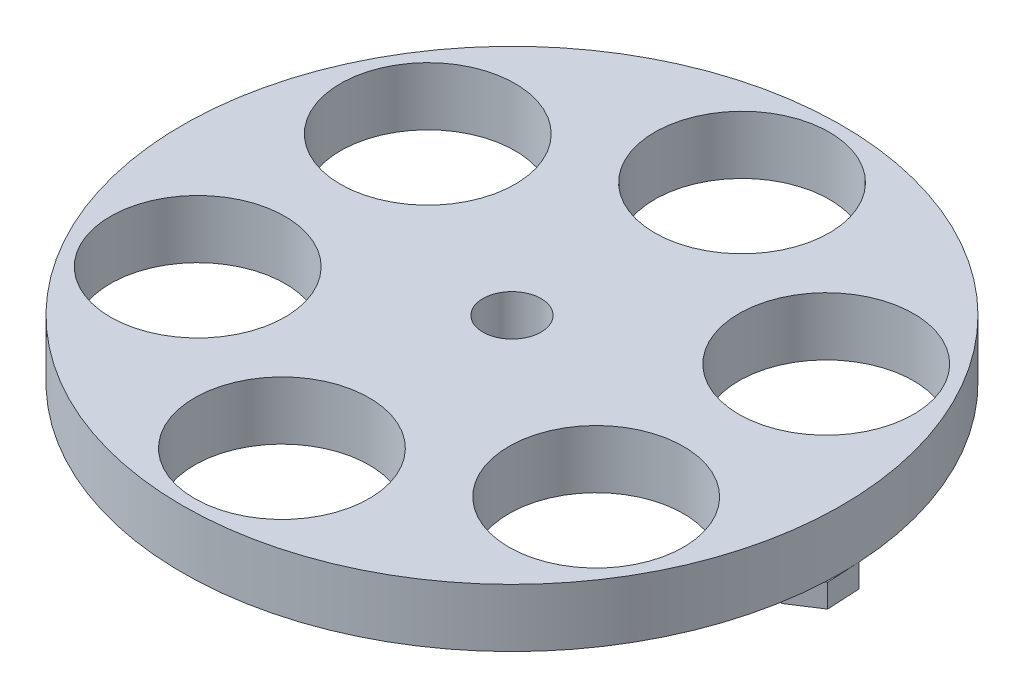
from build123d import *

# Parameters (mm, degrees)
CROQUIS1_R              = 113.228412481
CROQUIS1_R_2            = 30
CROQUIS1_R_3            = 10
SALIENTE_EXTRUIR2_DEPTH = 20
SALIENTE_EXTRUIR3_DEPTH = 8


with BuildPart() as part:
    # Croquis1 → Saliente-Extruir2 (new body)
    with BuildSketch(Plane(origin=(0, 0, 0), x_dir=(1, 0, 0), z_dir=(0, 1, 0))):
        with Locations(Location((0, 0, 0), (0, 0, 270))):
            Circle(CROQUIS1_R)
        with Locations(Location((0, 79.050232258, 0), (0, 0, 270))):
            Circle(CROQUIS1_R_2, mode=Mode.SUBTRACT)
        with Locations(Location((68.459509311, 39.525116129, 0), (0, 0, 270))):
            Circle(CROQUIS1_R_2, mode=Mode.SUBTRACT)
        with Locations(Location((68.459509311, -39.525116129, 0), (0, 0, 270))):
            Circle(CROQUIS1_R_2, mode=Mode.SUBTRACT)
        with Locations(Location((0, -79.050232258, 0), (0, 0, 270))):
            Circle(CROQUIS1_R_2, mode=Mode.SUBTRACT)
        with Locations(Location((-68.459509311, -39.525116129, 0), (0, 0, 270))):
            Circle(CROQUIS1_R_2, mode=Mode.SUBTRACT)
        with Locations(Location((-68.459509311, 39.525116129, 0), (0, 0, 270))):
            Circle(CROQUIS1_R_2, mode=Mode.SUBTRACT)
        with Locations(Location((0, 0, 0), (0, 0, 270))):
            Circle(CROQUIS1_R_3, mode=Mode.SUBTRACT)
    extrude(amount=SALIENTE_EXTRUIR2_DEPTH)

    # Croquis2 → Saliente-Extruir3 (add)
    with BuildSketch(Plane.XZ):
        Polygon((113.057016297, -6.227716999), (113.651716101, 5.197666723), (104.054393451, 11.425383723), (93.862370997, 6.227716999), (93.267671193, -5.197666723), (102.864993843, -11.425383723), align=None)
    extrude(amount=SALIENTE_EXTRUIR3_DEPTH)


solid = part.part
